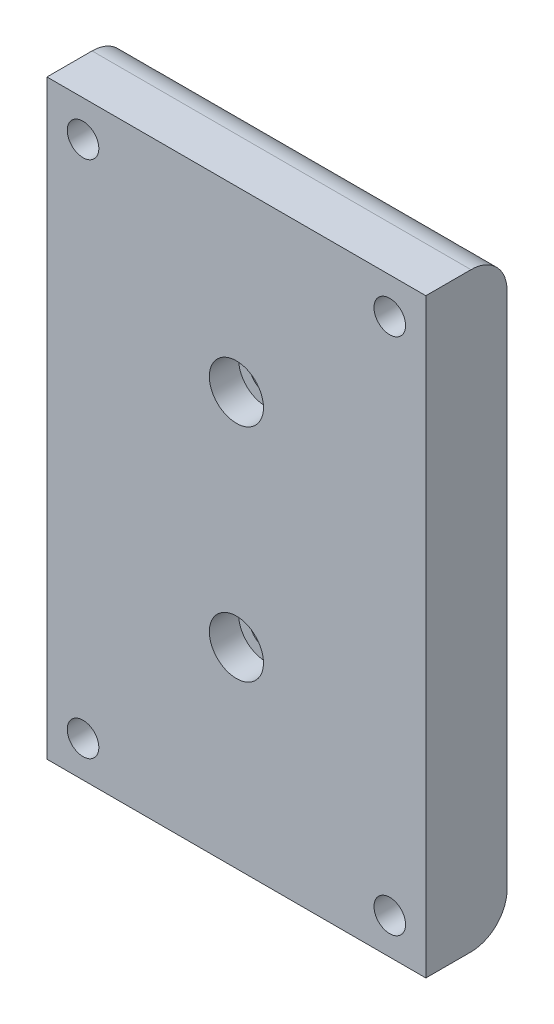
from build123d import *

# Parameters (mm, degrees)
SKETCH1_W           = 42
SKETCH1_H           = 65.5
BOSS_EXTRUDE1_DEPTH = 9
CUT_EXTRUDE2_DEPTH  = 4.5
SKETCH3_R           = 1.75
CUT_EXTRUDE5_DEPTH  = 78.939078773
SKETCH5_R           = 3
CUT_EXTRUDE6_DEPTH  = 3.25
FILLET1_R           = 4
SKETCH6_R           = 1.75
CUT_EXTRUDE7_DEPTH  = 79.327836687
SKETCH7_R           = 3
CUT_EXTRUDE8_DEPTH  = 3


with BuildPart() as part:
    # Sketch1 → Boss-Extrude1 (new body)
    with BuildSketch(Plane.XY):
        with Locations((21, 32.75)):
            Rectangle(SKETCH1_W, SKETCH1_H)
    extrude(amount=BOSS_EXTRUDE1_DEPTH)

    # Sketch2 → Cut-Extrude2 (cut)
    with BuildSketch(Plane(origin=(0, 0, 0), x_dir=(-1, 0, 0), z_dir=(0, 0, -1))):
        with BuildLine():
            Line((-25.5, 21.25), (-25.5, 35.084635496))
            ThreePointArc((-25.5, 35.084635496), (-25.998538124, 38.202683318), (-27.444444444, 41.009837998))
            ThreePointArc((-27.444444444, 41.009837998), (-21, 53.75), (-14.555555556, 41.009837998))
            ThreePointArc((-14.555555556, 41.009837998), (-16.001461876, 38.202683318), (-16.5, 35.084635496))
            Line((-16.5, 35.084635496), (-16.5, 21.25))
            ThreePointArc((-16.5, 21.25), (-21, 16.75), (-25.5, 21.25))
        make_face()
    extrude(amount=-CUT_EXTRUDE2_DEPTH, mode=Mode.SUBTRACT)

    # Sketch3 → Cut-Extrude5 (cut, through all)
    with BuildSketch(Plane(origin=(0, 0, 4.5), x_dir=(-1, 0, 0), z_dir=(0, 0, -1))):
        with Locations((-21, 21.25)):
            Circle(SKETCH3_R)
        with Locations((-21, 45.75)):
            Circle(SKETCH3_R)
    extrude(amount=-CUT_EXTRUDE5_DEPTH, mode=Mode.SUBTRACT)

    # Sketch5 → Cut-Extrude6 (cut)
    with BuildSketch(Plane.XY.offset(9)):
        with Locations((21, 21.25)):
            Circle(SKETCH5_R)
        with Locations((21, 45.75)):
            Circle(SKETCH5_R)
    extrude(amount=-CUT_EXTRUDE6_DEPTH, mode=Mode.SUBTRACT)

    # Fillet1
    fillet1_edges = [part.edges().sort_by_distance(p)[0] for p in [
        (21, 65.5, 0),
        (21, 0, 0),
    ]]
    fillet(fillet1_edges, radius=FILLET1_R)

    # Sketch6 → Cut-Extrude7 (cut, through all)
    with BuildSketch(Plane(origin=(0, 0, 0), x_dir=(-1, 0, 0), z_dir=(0, 0, -1))):
        with BuildLine():
            Line((-5.75, 4), (-2.25, 4))
            ThreePointArc((-2.25, 4), (-4, 5.75), (-5.75, 4))
        make_face()
        with BuildLine():
            ThreePointArc((-5.75, 4), (-4, 2.25), (-2.25, 4))
            Line((-2.25, 4), (-5.75, 4))
        make_face()
        with BuildLine():
            ThreePointArc((-39.75, 4), (-38, 2.25), (-36.25, 4))
            Line((-36.25, 4), (-39.75, 4))
        make_face()
        with BuildLine():
            Line((-39.75, 4), (-36.25, 4))
            ThreePointArc((-36.25, 4), (-38, 5.75), (-39.75, 4))
        make_face()
        with Locations((-38, 61.5)):
            Circle(SKETCH6_R)
        with Locations((-4, 61.5)):
            Circle(SKETCH6_R)
    extrude(amount=-CUT_EXTRUDE7_DEPTH, mode=Mode.SUBTRACT)

    # Sketch7 → Cut-Extrude8 (cut)
    with BuildSketch(Plane(origin=(0, 0, 0), x_dir=(-1, 0, 0), z_dir=(0, 0, -1))):
        with Locations((-38, 61.5)):
            Circle(SKETCH7_R)
        with Locations((-4, 61.5)):
            Circle(SKETCH7_R)
        with Locations((-4, 4)):
            Circle(SKETCH7_R)
        with Locations((-38, 4)):
            Circle(SKETCH7_R)
    extrude(amount=-CUT_EXTRUDE8_DEPTH, mode=Mode.SUBTRACT)


solid = part.part
